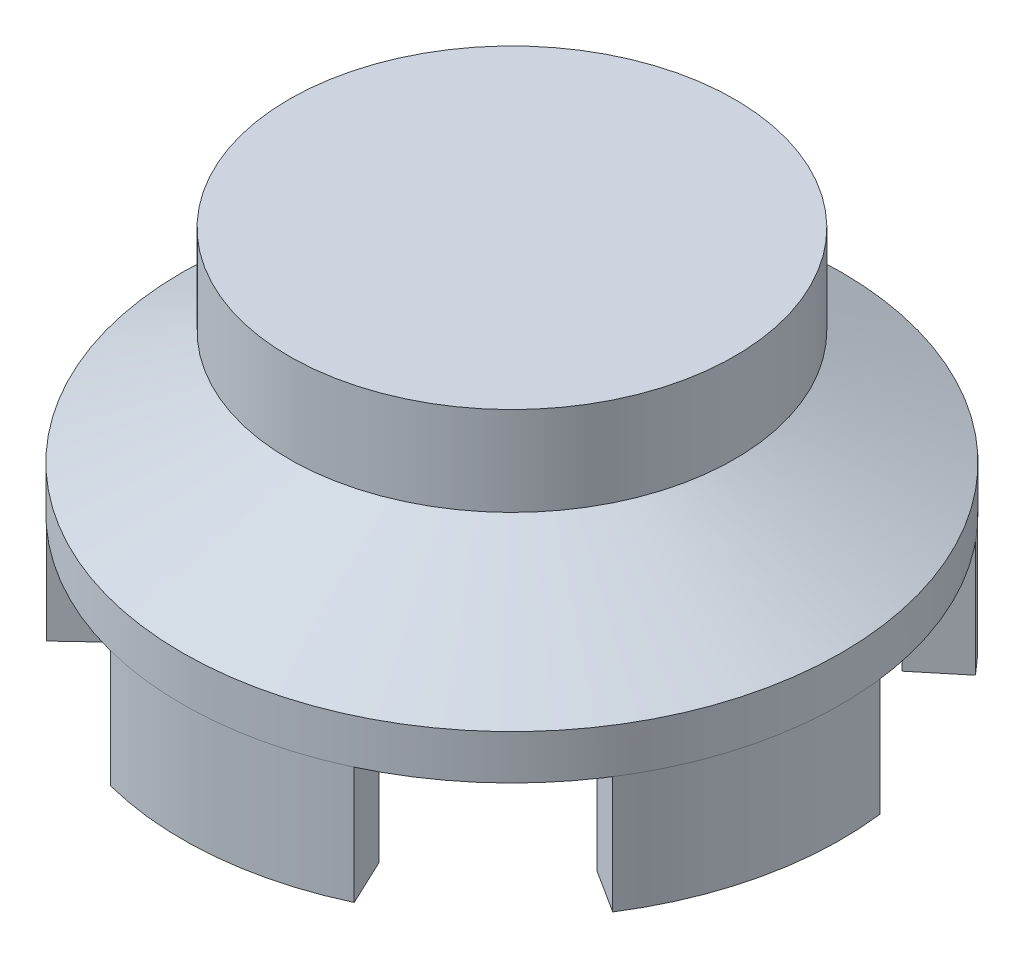
from build123d import *

# Parameters (mm, degrees)
EXTRUDE_START   = 3.5
EXTRUDE_3_DEPTH = 9
SKETCH_4_R      = 12.5
EXTRUDE_4_DEPTH = 5


with BuildPart() as part:
    # 草圖1 → 旋轉1 (revolve)
    with BuildSketch(Plane.XY):
        Polygon((0, 6.154761905), (0, 3.154761905), (4, 3.154761905), (15.5, -2.757936508), (18.5, -2.757936508), (18.5, -0.257936508), (4.354320213, 6.154761905), align=None)
    revolve(axis=Axis((0, 6.154761905, 0), (0, -1, 0)))

    # 草圖2 → 填料-伸長3 (add)
    with BuildSketch(Plane.XZ.offset(-3.154761905).offset(EXTRUDE_START)):
        with BuildLine():
            Line((-4.628340567, 17.895656272), (-3.896757076, 15.066960653))
            ThreePointArc((-3.896757076, 15.066960653), (1.45159982, 15.49486615), (6.627417355, 14.081028309))
            Line((6.627417355, 14.081028309), (7.871659433, 16.724623391))
            ThreePointArc((7.871659433, 16.724623391), (1.724125523, 18.40389744), (-4.628340567, 17.895656272))
        make_face()
        with BuildLine():
            Line((18.338538597, -2.318200146), (15.439838321, -1.951771416))
            ThreePointArc((15.439838321, -1.951771416), (15.185062434, 3.407623498), (13.12536695, 8.361983105))
            Line((13.12536695, 8.361983105), (15.58954462, 9.931875369))
            ThreePointArc((15.58954462, 9.931875369), (18.035930673, 4.047376258), (18.338538597, -2.318200146))
        make_face()
        with BuildLine():
            Line((3.462180724, -18.157349874), (2.914927508, -15.287289382))
            ThreePointArc((2.914927508, -15.287289382), (7.933284886, -13.388839007), (12.008679966, -9.898970881))
            Line((12.008679966, -9.898970881), (14.263209011, -11.757419722))
            ThreePointArc((14.263209011, -11.757419722), (9.422692651, -15.902481347), (3.462180724, -18.157349874))
        make_face()
        with BuildLine():
            Line((-16.198793235, -8.903659222), (-13.638314046, -7.496293018))
            ThreePointArc((-13.638314046, -7.496293018), (-10.282022732, -11.682381074), (-5.703594571, -14.479883563))
            Line((-5.703594571, -14.479883563), (-6.774396662, -17.198360377))
            ThreePointArc((-6.774396662, -17.198360377), (-12.212386349, -13.875650236), (-16.198793235, -8.903659222))
        make_face()
        with BuildLine():
            Line((-13.47358552, 12.65458585), (-11.343869138, 10.654325507))
            ThreePointArc((-11.343869138, 10.654325507), (-14.287924407, 6.168730433), (-15.533695269, 0.949910686))
            Line((-15.533695269, 0.949910686), (-18.450016402, 1.128248458))
            ThreePointArc((-18.450016402, 1.128248458), (-16.970362498, 7.326857885), (-13.47358552, 12.65458585))
        make_face()
    extrude(amount=EXTRUDE_3_DEPTH)

    # 草圖4 → 填料-伸長4 (add)
    with BuildSketch(Plane(origin=(0, 6.154761905, 0), x_dir=(1, 0, 0), z_dir=(0, 1, 0))):
        with Locations(Location((0, 0, 0), (0, 0, 180))):
            Circle(SKETCH_4_R)
    extrude(amount=EXTRUDE_4_DEPTH)


solid = part.part
